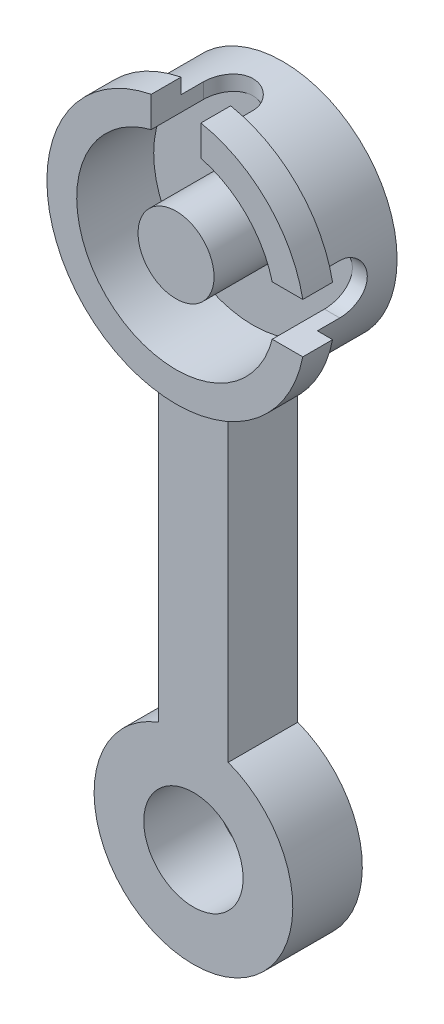
from build123d import *

# Parameters (mm, degrees)
CROQUIS1_R                  = 10
SALIENTE_EXTRUIR1_DEPTH     = 3
CROQUIS2_R                  = 11.5
CROQUIS2_R_2                = 10
SALIENTE_EXTRUIR3_DEPTH     = 8
SALIENTE_EXTRUIR4_START     = 3
CROQUIS3_R                  = 11.5
CROQUIS3_R_2                = 10
SALIENTE_EXTRUIR4_DEPTH     = 3
CROQUIS12_W                 = 2.5
CROQUIS12_H                 = 0.622045166
SALIENTE_EXTRUIR6_DEPTH     = 3
CROQUIS13_W                 = 5
CROQUIS13_H                 = 50.27502784
SALIENTE_EXTRUIR7_DEPTH     = 8
CROQUIS15_W                 = 2
CROQUIS15_H                 = 50.27502784
CORTAR_EXTRUIR4_DEPTH       = 8
SALIENTE_EXTRUIR8_DEPTH     = 7
CROQUIS21_R                 = 10
SALIENTE_EXTRUIR9_DEPTH     = 7
CROQUIS22_R                 = 5
CORTAR_EXTRUIR5_DEPTH       = 30
CROQUIS23_R                 = 10
SALIENTE_EXTRUIR10_DEPTH    = 1.25
CORTAR_EXTRUIR6_START       = -1.5
CROQUIS24_R                 = 10
CORTAR_EXTRUIR6_DEPTH       = 1.5
SALIENTE_EXTRUIR11_START    = -3
CROQUIS25_R                 = 13
SALIENTE_EXTRUIR11_DEPTH    = 3
CORTAR_EXTRUIR14_START      = -10
CROQUIS30_R                 = 10
CORTAR_EXTRUIR14_DEPTH      = 10
CROQUIS31_R                 = 11.5
CROQUIS31_R_2               = 10
SALIENTE_EXTRUIR12_DEPTH    = 7.75
CROQUIS32_R                 = 10
SALIENTE_EXTRUIR13_DEPTH    = 10.75
CROQUIS34_R                 = 10
CORTAR_EXTRUIR15_DEPTH      = 7.75
CROQUIS36_R                 = 3.825
SALIENTE_EXTRUIR14_DEPTH    = 7.75
CORTAR_EXTRUIR17_DEPTH      = 77.117731129
CORTAR_EXTRUIR17_DEPTH_BACK = 5.5
SALIENTE_EXTRUIR20_DEPTH    = 9.5
CROQUIS42_W                 = 1.65191017
CROQUIS42_H                 = 5
CORTAR_EXTRUIR18_DEPTH      = 0.25
CORTAR_EXTRUIR19_REACH      = 71.382
CORTAR_EXTRUIR20_REACH      = 71.382
CORTAR_EXTRUIR20_END_RADIUS = 10


with BuildPart() as part:
    # Croquis1 → Saliente-Extruir1 (new body)
    with BuildSketch(Plane.XY):
        Circle(CROQUIS1_R)
    extrude(amount=SALIENTE_EXTRUIR1_DEPTH)



with BuildPart() as body_2:
    # Croquis2 → Saliente-Extruir3 (new body)
    with BuildSketch(Plane.XY.offset(3)):
        Circle(CROQUIS2_R)
        Circle(CROQUIS2_R_2, mode=Mode.SUBTRACT)
    extrude(amount=SALIENTE_EXTRUIR3_DEPTH)


with BuildPart() as part_1:
    add(part.part)

    add(body_2.part)  # Saliente-Extruir4 merges body 2
    # Croquis3 → Saliente-Extruir4 (add)
    with BuildSketch(Plane(origin=(0, 0, 3), x_dir=(-1, 0, 0), z_dir=(0, 0, -1)).offset(SALIENTE_EXTRUIR4_START)):
        with Locations(Location((0, 0, 0), (0, 0, 180))):
            Circle(CROQUIS3_R)
        with Locations(Location((0, 0, 0), (0, 0, 180))):
            Circle(CROQUIS3_R_2, mode=Mode.SUBTRACT)
    extrude(amount=-SALIENTE_EXTRUIR4_DEPTH)

    # Croquis12 → Saliente-Extruir6 (add)
    with BuildSketch(Plane.XY.offset(3)):
        with Locations((-1.25, -11.188977417)):
            Rectangle(CROQUIS12_W, CROQUIS12_H)
        with Locations((1.25, -11.188977417)):
            Rectangle(CROQUIS12_W, CROQUIS12_H)
        Polygon((2.5, -11.5), (2.5, -61.5), (-2.5, -61.5), (-2.5, -11.5), (0, -11.5), align=None)
    extrude(amount=-SALIENTE_EXTRUIR6_DEPTH)

    # Croquis13 → Saliente-Extruir7 (add)
    with BuildSketch(Plane.XY.offset(3)):
        with Locations((0, -36.36248608)):
            Rectangle(CROQUIS13_W, CROQUIS13_H)
    extrude(amount=SALIENTE_EXTRUIR7_DEPTH)

    # Croquis15 → Cortar-Extruir4 (cut)
    with BuildSketch(Plane(origin=(2.5, 0, 0), x_dir=(0, 0, -1), z_dir=(1, 0, 0))):
        with Locations((-10, -36.36248608)):
            Rectangle(CROQUIS15_W, CROQUIS15_H)
        with Locations((-1, -36.36248608)):
            Rectangle(CROQUIS15_W, CROQUIS15_H)
    extrude(amount=-CORTAR_EXTRUIR4_DEPTH, mode=Mode.SUBTRACT)

    # Croquis16 → Saliente-Extruir8 (add)
    with BuildSketch(Plane.XY.offset(9)):
        Polygon((-2.5, -61.5), (-3.5, -61.5), (-3.5, -10.232955502), (3.5, -10.232955502), (3.5, -61.5), (2.5, -61.5), align=None)
    extrude(amount=-SALIENTE_EXTRUIR8_DEPTH)

    # Croquis21 → Saliente-Extruir9 (add)
    with BuildSketch(Plane(origin=(0, 0, 2), x_dir=(-1, 0, 0), z_dir=(0, 0, -1))):
        with Locations((0, -52.72497216)):
            Circle(CROQUIS21_R)
    extrude(amount=-SALIENTE_EXTRUIR9_DEPTH)

    # Croquis22 → Cortar-Extruir5 (cut)
    with BuildSketch(Plane(origin=(0, 0, 2), x_dir=(-1, 0, 0), z_dir=(0, 0, -1))):
        with Locations((0, -52.72497216)):
            Circle(CROQUIS22_R)
    extrude(amount=-CORTAR_EXTRUIR5_DEPTH, mode=Mode.SUBTRACT)

    # Croquis23 → Saliente-Extruir10 (add)
    with BuildSketch(Plane.XY.offset(11)):
        with BuildLine():
            Line((-2.5, -11.22497216), (2.5, -11.22497216))
            ThreePointArc((2.5, -11.22497216), (0, 11.5), (-2.5, -11.22497216))
        make_face()
        Circle(CROQUIS23_R, mode=Mode.SUBTRACT)
    extrude(amount=SALIENTE_EXTRUIR10_DEPTH)

    # Croquis24 → Cortar-Extruir6 (cut)
    with BuildSketch(Plane.XY.offset(12.25).offset(CORTAR_EXTRUIR6_START)):
        with BuildLine():
            Line((-2.5, -11.22497216), (2.5, -11.22497216))
            ThreePointArc((2.5, -11.22497216), (0, 11.5), (-2.5, -11.22497216))
        make_face()
        Circle(CROQUIS24_R, mode=Mode.SUBTRACT)
    extrude(amount=CORTAR_EXTRUIR6_DEPTH, mode=Mode.SUBTRACT)

    # Croquis25 → Saliente-Extruir11 (add)
    with BuildSketch(Plane.XY.offset(10.75).offset(SALIENTE_EXTRUIR11_START)):
        Circle(CROQUIS25_R)
        with BuildLine():
            ThreePointArc((2.5, -11.22497216), (0, 11.5), (-2.5, -11.22497216))
            Line((-2.5, -11.22497216), (2.5, -11.22497216))
        make_face(mode=Mode.SUBTRACT)
    extrude(amount=SALIENTE_EXTRUIR11_DEPTH)

    # Croquis30 → Cortar-Extruir14 (cut)
    with BuildSketch(Plane.XY.offset(3).offset(CORTAR_EXTRUIR14_START)):
        Circle(CROQUIS30_R)
    extrude(amount=CORTAR_EXTRUIR14_DEPTH, mode=Mode.SUBTRACT)

    # Croquis31 → Saliente-Extruir12 (add)
    with BuildSketch(Plane(origin=(0, 0, 0), x_dir=(-1, 0, 0), z_dir=(0, 0, -1))):
        with Locations(Location((0, 0, 0), (0, 0, 180))):
            Circle(CROQUIS31_R)
        with Locations(Location((0, 0, 0), (0, 0, 180))):
            Circle(CROQUIS31_R_2, mode=Mode.SUBTRACT)
    extrude(amount=-SALIENTE_EXTRUIR12_DEPTH)

    # Croquis32 → Saliente-Extruir13 (add)
    with BuildSketch(Plane(origin=(0, 0, 0), x_dir=(-1, 0, 0), z_dir=(0, 0, -1))):
        Circle(CROQUIS32_R)
    extrude(amount=-SALIENTE_EXTRUIR13_DEPTH)

    # Croquis34 → Cortar-Extruir15 (cut)
    with BuildSketch(Plane.XY.offset(10.75)):
        Circle(CROQUIS34_R)
    extrude(amount=-CORTAR_EXTRUIR15_DEPTH, mode=Mode.SUBTRACT)

    # Croquis36 → Saliente-Extruir14 (add)
    with BuildSketch(Plane.XY.offset(3)):
        Circle(CROQUIS36_R)
    extrude(amount=SALIENTE_EXTRUIR14_DEPTH)

    # Croquis40 → Cortar-Extruir17 (cut, two sides: drawn at the far end of the back side and taken through both)
    with BuildSketch(Plane(origin=(0, 11.5, 0), x_dir=(1, 0, 0), z_dir=(0, 1, 0)).offset(-CORTAR_EXTRUIR17_DEPTH_BACK)):
        with BuildLine():
            Line((-2.5, -5.5), (-2.5, -10.75))
            Line((-2.5, -10.75), (0, -10.75))
            Line((0, -10.75), (2.5, -10.75))
            Line((2.5, -10.75), (2.5, -5.5))
            ThreePointArc((2.5, -5.5), (0, -3), (-2.5, -5.5))
        make_face()
        with BuildLine():
            Line((0, -10.75), (-2.5, -10.75))
            ThreePointArc((-2.5, -10.75), (0, -13.25), (2.5, -10.75))
            Line((2.5, -10.75), (0, -10.75))
        make_face()
    extrude(amount=CORTAR_EXTRUIR17_DEPTH + CORTAR_EXTRUIR17_DEPTH_BACK, mode=Mode.SUBTRACT)

    # Croquis7 → Saliente-Extruir20 (add)
    with BuildSketch(Plane.XY.offset(11)):
        Polygon((14.638643631, -2.5), (12.986733461, -2.5), (12.986733461, 0), (12.986733461, 2.5), (14.638643631, 2.5), align=None)
    extrude(amount=-SALIENTE_EXTRUIR20_DEPTH)

    # Croquis42 → Cortar-Extruir18 (cut)
    with BuildSketch(Plane.XY.offset(11)):
        with Locations((13.812688546, 0)):
            Rectangle(CROQUIS42_W, CROQUIS42_H)
    extrude(amount=-CORTAR_EXTRUIR18_DEPTH, mode=Mode.SUBTRACT)

    # Croquis43 → Cortar-Extruir19 (cut, up to next)
    with BuildSketch(Plane(origin=(14.638643631, 0, 0), x_dir=(0, 0, -1), z_dir=(1, 0, 0)), mode=Mode.PRIVATE) as cortar_extruir19_sk1:
        with BuildLine():
            Line((-1.5, 2.5), (-5.5, 2.5))
            ThreePointArc((-5.5, 2.5), (-3, 0), (-5.5, -2.5))
            Line((-5.5, -2.5), (-1.5, -2.5))
            Line((-1.5, -2.5), (-1.5, 2.5))
        make_face()
    cortar_extruir19_tool1 = extrude(cortar_extruir19_sk1.sketch, amount=-CORTAR_EXTRUIR19_REACH, mode=Mode.PRIVATE) & part_1.part
    add(cortar_extruir19_tool1.solids().sort_by_distance((14.638644, 0, 2.594695))[0], mode=Mode.SUBTRACT)

    # Cortar-Extruir20: up to this cylinder (the profile starts outside it)
    cortar_extruir20_end = Plane(origin=(0, 0, 7.121671), z_dir=(0, 0, 1)) * Cylinder(CORTAR_EXTRUIR20_END_RADIUS, 163.764, mode=Mode.PRIVATE)
    # Croquis44 → Cortar-Extruir20 (cut, up to the surface)
    with BuildSketch(Plane(origin=(14.638643631, 0, 0), x_dir=(0, 0, -1), z_dir=(1, 0, 0)), mode=Mode.PRIVATE) as cortar_extruir20_sk1:
        with BuildLine():
            Line((-5.5, 2.5), (-10.75, 2.5))
            Line((-10.75, 2.5), (-10.75, -2.5))
            Line((-10.75, -2.5), (-5.5, -2.5))
            ThreePointArc((-5.5, -2.5), (-3, 0), (-5.5, 2.5))
        make_face()
    cortar_extruir20_tool1 = extrude(cortar_extruir20_sk1.sketch, amount=-CORTAR_EXTRUIR20_REACH, mode=Mode.PRIVATE) - cortar_extruir20_end
    add(cortar_extruir20_tool1.solids().sort_by_distance((14.638644, 0, 7.121671))[0], mode=Mode.SUBTRACT)


solid = part_1.part
